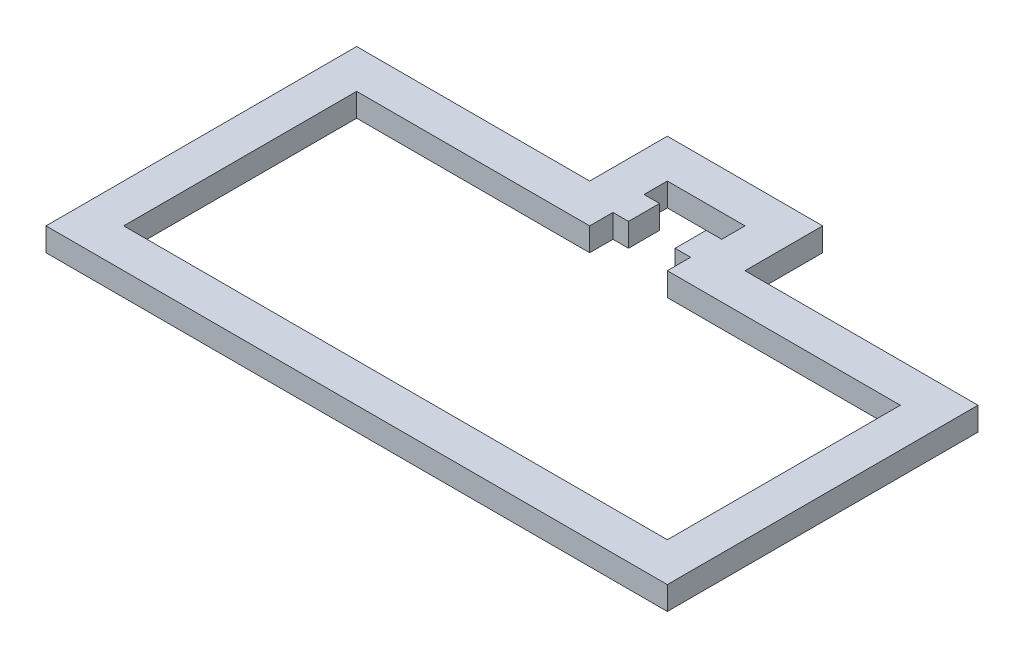
from build123d import *

# Parameters (mm, degrees)
SKETCH1_W           = 20
SKETCH1_H           = 40
BOSS_EXTRUDE1_DEPTH = 30


with BuildPart() as part:
    # Sketch1 → Boss-Extrude1 (new body)
    with BuildSketch(Plane(origin=(0, 0, 0), x_dir=(1, 0, 0), z_dir=(0, 1, 0))):
        Polygon((-99.811676083, 165.128212813), (-399.811676083, 165.128212813), (-399.811676083, -234.871787187), (400.188323917, -234.871787187), (400.188323917, 165.128212813), (100.188323917, 165.128212813), (50.188323917, 165.128212813), (50.188323917, 145.128212813), (50.188323917, 115.128212813), (350.188323917, 115.128212813), (350.188323917, -184.871787187), (-349.811676083, -184.871787187), (-349.811676083, 115.128212813), (-49.811676083, 115.128212813), (-49.811676083, 145.128212813), (-49.811676083, 165.128212813), align=None)
        Polygon((-99.811676083, 265.128212813), (-99.811676083, 165.128212813), (-49.811676083, 165.128212813), (-49.811676083, 185.128212813), (-49.811676083, 215.128212813), (50.188323917, 215.128212813), (50.188323917, 185.128212813), (50.188323917, 165.128212813), (100.188323917, 165.128212813), (100.188323917, 265.128212813), align=None)
        with Locations((-39.811676083, 165.128212813)):
            Rectangle(SKETCH1_W, SKETCH1_H)
        with Locations((40.188323917, 165.128212813)):
            Rectangle(SKETCH1_W, SKETCH1_H)
    extrude(amount=BOSS_EXTRUDE1_DEPTH)


solid = part.part
